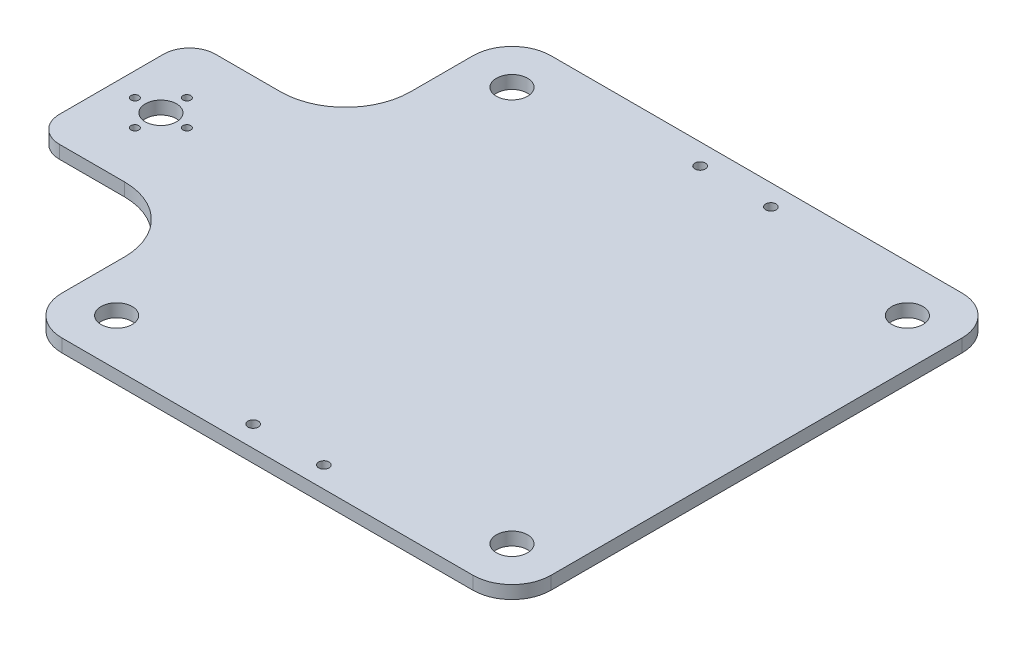
from build123d import *

# Parameters (mm, degrees)
SKETCH1_R           = 6
SKETCH1_R_2         = 1.5
SKETCH1_R_3         = 2
BOSS_EXTRUDE1_DEPTH = 2.5
FILLET1_R           = 25
FILLET2_R           = 10


with BuildPart() as part:
    # Sketch1 → Boss-Extrude1 (new, symmetric)
    with BuildSketch(Plane(origin=(0, 0, 0), x_dir=(1, 0, 0), z_dir=(0, 1, 0))):
        with BuildLine():
            Line((-79, 94), (79, 94))
            ThreePointArc((79, 94), (89.606601718, 89.606601718), (94, 79))
            Line((94, 79), (94, -79))
            ThreePointArc((94, -79), (89.606601718, -89.606601718), (79, -94))
            Line((79, -94), (-79, -94))
            ThreePointArc((-79, -94), (-89.606601718, -89.606601718), (-94, -79))
            Line((-94, -79), (-94, -30))
            Line((-94, -30), (-154, -30))
            Line((-154, -30), (-154, 30))
            Line((-154, 30), (-94, 30))
            Line((-94, 30), (-94, 79))
            ThreePointArc((-94, 79), (-89.606601718, 89.606601718), (-79, 94))
        make_face()
        with Locations(Location((-76.013978978, 76.013978978, 0), (0, 0, 270))):
            Circle(SKETCH1_R, mode=Mode.SUBTRACT)
        with Locations(Location((76.013978978, 76.013978978, 0), (0, 0, 270))):
            Circle(SKETCH1_R, mode=Mode.SUBTRACT)
        with Locations(Location((76.013978978, -76.013978978, 0), (0, 0, 270))):
            Circle(SKETCH1_R, mode=Mode.SUBTRACT)
        with Locations(Location((-76.013978978, -76.013978978, 0), (0, 0, 270))):
            Circle(SKETCH1_R, mode=Mode.SUBTRACT)
        with Locations(Location((-135, -10, 0), (0, 0, 270))):
            Circle(SKETCH1_R_2, mode=Mode.SUBTRACT)
        with Locations(Location((-145, 0, 0), (0, 0, 270))):
            Circle(SKETCH1_R_2, mode=Mode.SUBTRACT)
        with Locations(Location((-135, 10, 0), (0, 0, 270))):
            Circle(SKETCH1_R_2, mode=Mode.SUBTRACT)
        with Locations(Location((-125, 0, 0), (0, 0, 270))):
            Circle(SKETCH1_R_2, mode=Mode.SUBTRACT)
        with Locations(Location((-135, 0, 0), (0, 0, 270))):
            Circle(SKETCH1_R, mode=Mode.SUBTRACT)
        with Locations(Location((13.609798459, 85.928885632, 0), (0, 0, 270))):
            Circle(SKETCH1_R_3, mode=Mode.SUBTRACT)
        with Locations(Location((13.609798458, -85.928885632, 0), (0, 0, 270))):
            Circle(SKETCH1_R_3, mode=Mode.SUBTRACT)
        with Locations(Location((-13.609798458, 85.928885632, 0), (0, 0, 270))):
            Circle(SKETCH1_R_3, mode=Mode.SUBTRACT)
        with Locations(Location((-13.609798459, -85.928885632, 0), (0, 0, 270))):
            Circle(SKETCH1_R_3, mode=Mode.SUBTRACT)
    extrude(amount=BOSS_EXTRUDE1_DEPTH, both=True)

    # Fillet1
    fillet1_edges = [part.edges().sort_by_distance(p)[0] for p in [
        (-94, 0, 30),
        (-94, 0, -30),
    ]]
    fillet(fillet1_edges, radius=FILLET1_R)

    # Fillet2
    fillet2_edges = [part.edges().sort_by_distance(p)[0] for p in [
        (-154, 0, 30),
        (-154, 0, -30),
    ]]
    fillet(fillet2_edges, radius=FILLET2_R)


solid = part.part
